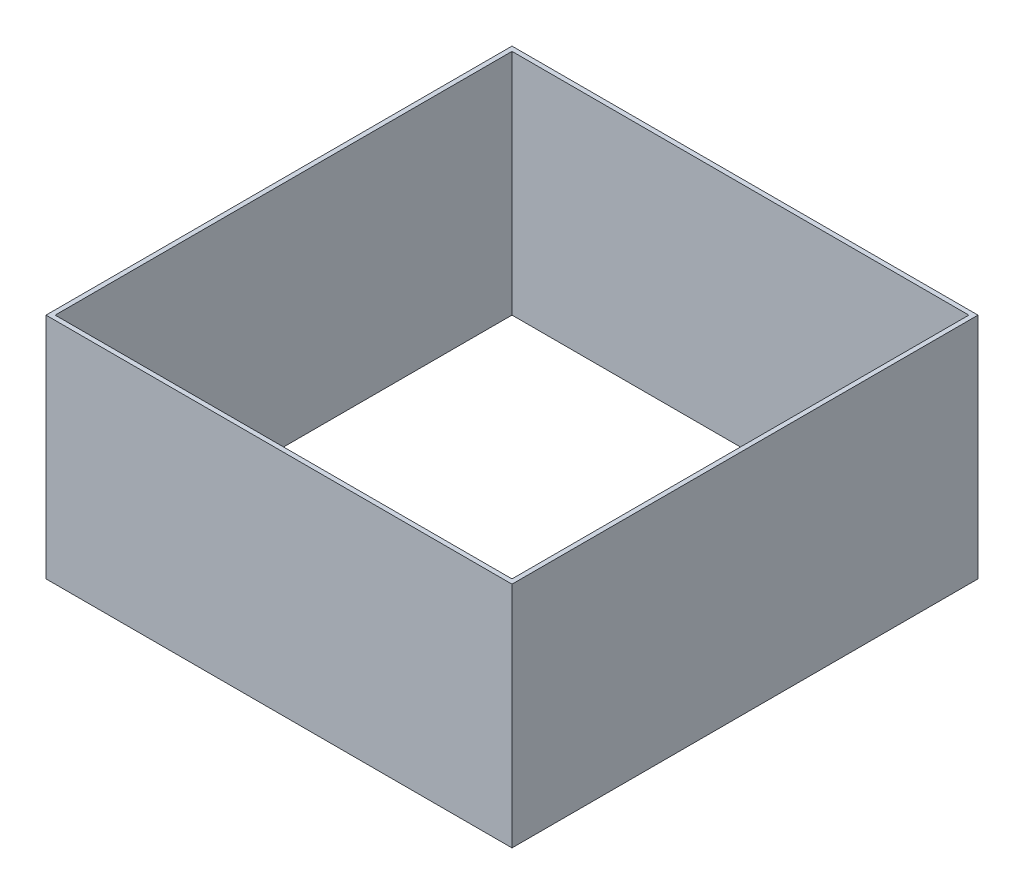
from build123d import *

# Parameters (mm, degrees)
CROQUIS1_W              = 204
CROQUIS1_H              = 204
CROQUIS1_W_2            = 200
CROQUIS1_H_2            = 200
SALIENTE_EXTRUIR1_DEPTH = 100


with BuildPart() as part:
    # Croquis1 → Saliente-Extruir1 (new body)
    with BuildSketch(Plane(origin=(0, 0, 0), x_dir=(1, 0, 0), z_dir=(0, 1, 0))):
        Rectangle(CROQUIS1_W, CROQUIS1_H)
        Rectangle(CROQUIS1_W_2, CROQUIS1_H_2, mode=Mode.SUBTRACT)
    extrude(amount=SALIENTE_EXTRUIR1_DEPTH)


solid = part.part
